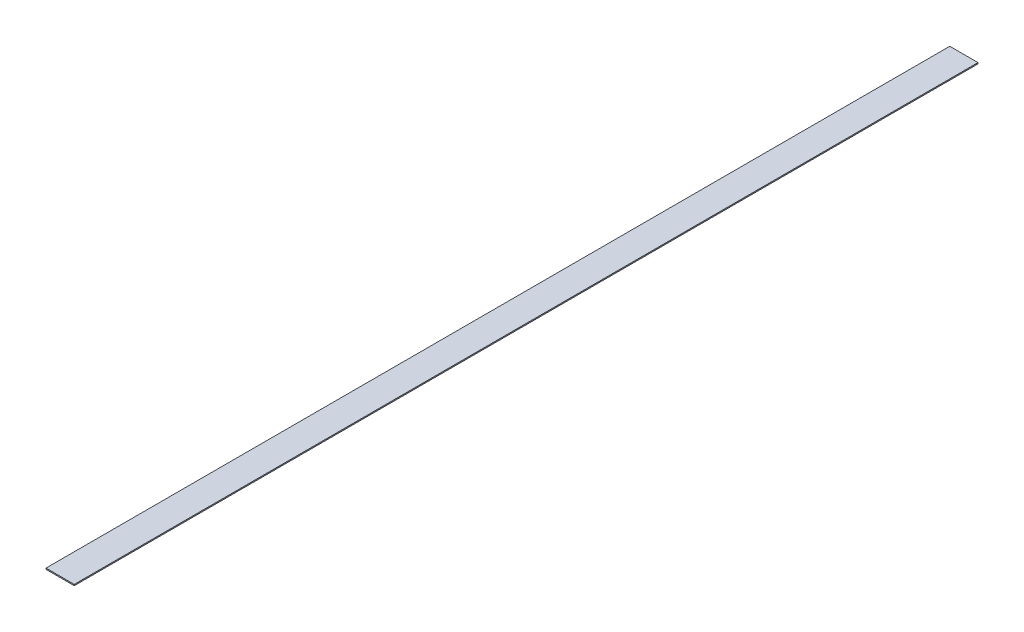
from build123d import *

# Parameters (mm, degrees)
SKETCH1_W      = 19.05
SKETCH1_H      = 609.6
EXTRUDE1_DEPTH = 0.79375


with BuildPart() as part:
    # Sketch1 → Extrude1 (new body)
    with BuildSketch(Plane(origin=(0, 0, 0), x_dir=(1, 0, 0), z_dir=(0, 1, 0))):
        Rectangle(SKETCH1_W, SKETCH1_H)
    extrude(amount=EXTRUDE1_DEPTH)


solid = part.part
